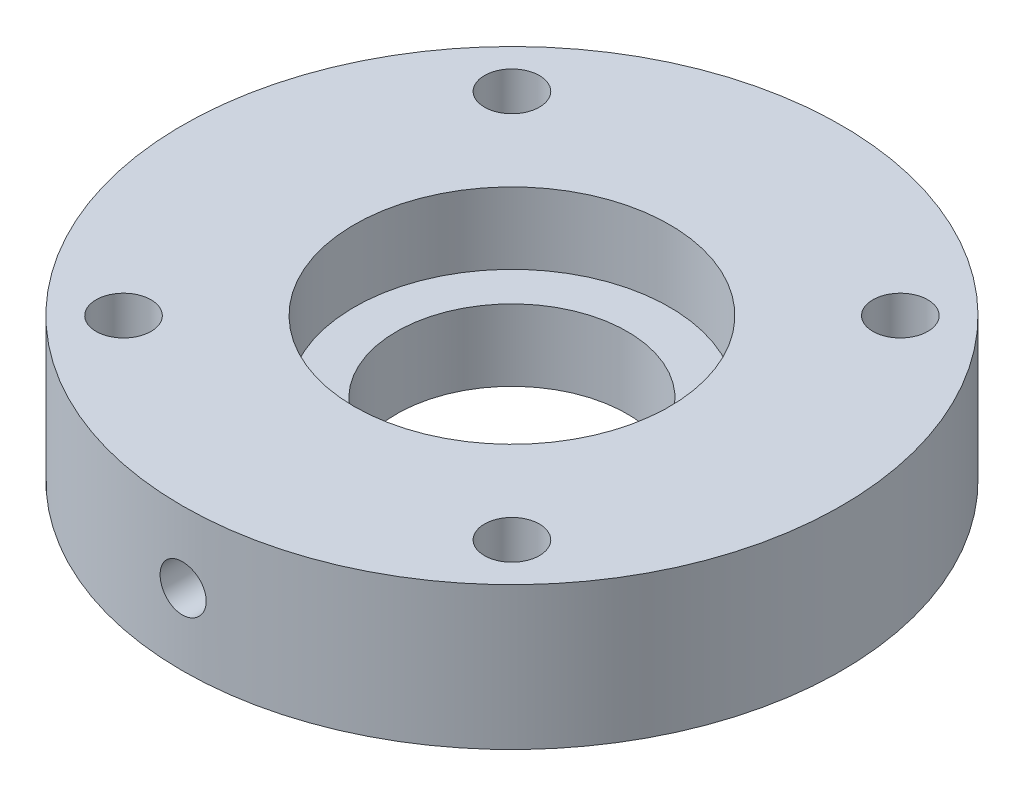
from build123d import *

# Parameters (mm, degrees)
BOSS_EXTRUDE1_DEPTH      = 6.5
BOSS_EXTRUDE1_DEPTH_BACK = 6.5
SKETCH1_R                = 30
SKETCH1_R_2              = 10.5
SKETCH1_R_3              = 2.5
SKETCH2_R                = 14.35
CUT_EXTRUDE1_DEPTH       = 7.9375
CUT_EXTRUDE3_START       = -6.5
SKETCH3_R                = 4.5
CUT_EXTRUDE3_DEPTH       = 6
CUT_EXTRUDE4_START       = 30
SKETCH4_R                = 2.1
CUT_EXTRUDE4_DEPTH       = 15


with BuildPart() as part:
    # Sketch1 → Boss-Extrude1 (new, two sides: drawn at the far end of the back side and taken through both)
    with BuildSketch(Plane(origin=(0, 0, 0), x_dir=(1, 0, 0), z_dir=(0, 1, 0)).offset(-BOSS_EXTRUDE1_DEPTH_BACK)):
        with Locations(Location((0, 0, 0), (0, 0, 270))):
            Circle(SKETCH1_R)
        with Locations(Location((0, 0, 0), (0, 0, 270))):
            Circle(SKETCH1_R_2, mode=Mode.SUBTRACT)
        with Locations(Location((17.67766953, 17.67766953, 0), (0, 0, 270))):
            Circle(SKETCH1_R_3, mode=Mode.SUBTRACT)
        with Locations(Location((17.67766953, -17.67766953, 0), (0, 0, 270))):
            Circle(SKETCH1_R_3, mode=Mode.SUBTRACT)
        with Locations(Location((-17.67766953, -17.67766953, 0), (0, 0, 270))):
            Circle(SKETCH1_R_3, mode=Mode.SUBTRACT)
        with Locations(Location((-17.67766953, 17.67766953, 0), (0, 0, 270))):
            Circle(SKETCH1_R_3, mode=Mode.SUBTRACT)
    extrude(amount=BOSS_EXTRUDE1_DEPTH + BOSS_EXTRUDE1_DEPTH_BACK)

    # Sketch2 → Cut-Extrude1 (cut)
    with BuildSketch(Plane(origin=(0, 0, 0), x_dir=(1, 0, 0), z_dir=(0, 1, 0))):
        with Locations(Location((0, 0, 0), (0, 0, 270))):
            Circle(SKETCH2_R)
    extrude(amount=CUT_EXTRUDE1_DEPTH, mode=Mode.SUBTRACT)

    # Sketch3 → Cut-Extrude3 (cut)
    with BuildSketch(Plane(origin=(0, 0, 0), x_dir=(1, 0, 0), z_dir=(0, 1, 0)).offset(CUT_EXTRUDE3_START)):
        with Locations(Location((17.67766953, 17.67766953, 0), (0, 0, 270))):
            Circle(SKETCH3_R)
        with Locations(Location((17.67766953, -17.67766953, 0), (0, 0, 270))):
            Circle(SKETCH3_R)
        with Locations(Location((-17.67766953, -17.67766953, 0), (0, 0, 270))):
            Circle(SKETCH3_R)
        with Locations(Location((-17.67766953, 17.67766953, 0), (0, 0, 270))):
            Circle(SKETCH3_R)
    extrude(amount=CUT_EXTRUDE3_DEPTH, mode=Mode.SUBTRACT)

    # Sketch4 → Cut-Extrude4 (cut)
    with BuildSketch(Plane.XY.offset(CUT_EXTRUDE4_START)):
        Circle(SKETCH4_R)
    extrude(amount=-CUT_EXTRUDE4_DEPTH, mode=Mode.SUBTRACT)


solid = part.part
